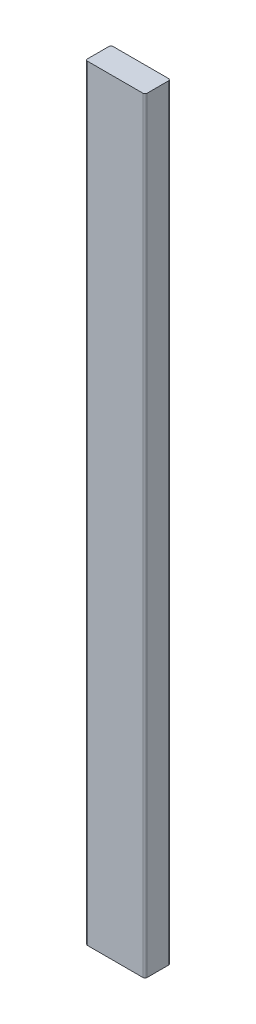
from build123d import *

# Parameters (mm, degrees)
SKETCH1_W           = 88.9
SKETCH1_H           = 38.1
BOSS_EXTRUDE1_DEPTH = 1143
FILLET1_R           = 3.175


with BuildPart() as part:
    # Sketch1 → Boss-Extrude1 (new body)
    with BuildSketch(Plane(origin=(0, 0, 0), x_dir=(1, 0, 0), z_dir=(0, 1, 0))):
        Rectangle(SKETCH1_W, SKETCH1_H)
    extrude(amount=BOSS_EXTRUDE1_DEPTH)

    # Fillet1
    fillet1_edges = [part.edges().sort_by_distance(p)[0] for p in [
        (-44.45, 571.5, -19.05),
        (44.45, 571.5, -19.05),
        (44.45, 571.5, 19.05),
        (-44.45, 571.5, 19.05),
    ]]
    fillet(fillet1_edges, radius=FILLET1_R)


solid = part.part
